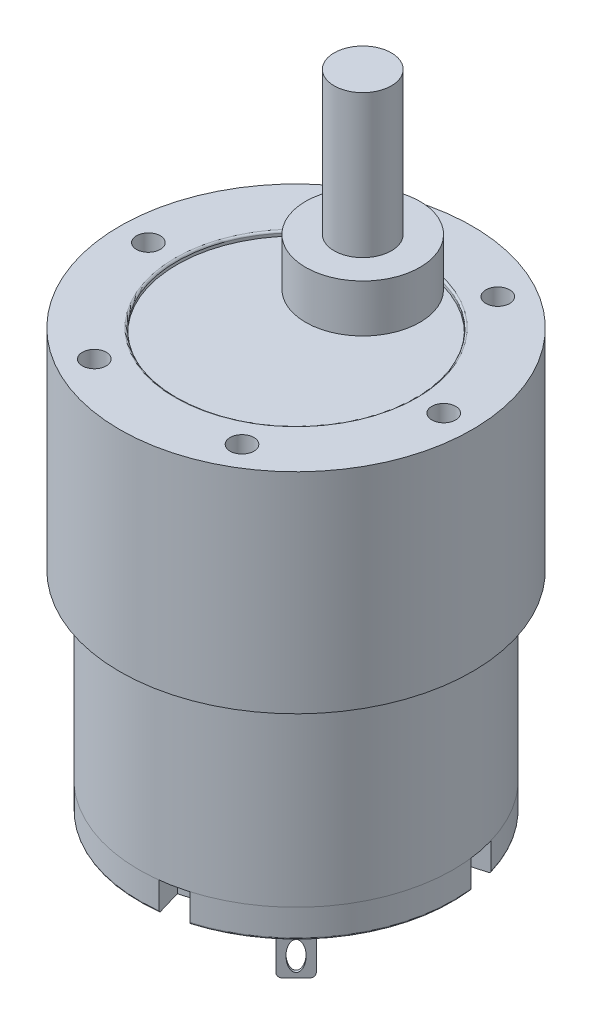
from build123d import *

# Parameters (mm, degrees)
PATTERN_CIRCULAR_1_COUNT = 6
SKETCH_4_R               = 6
EXTRUDE_1_DEPTH          = 5
SKETCH_5_R               = 3
EXTRUDE_2_DEPTH          = 15
SKETCH_6_R               = 3.75
EXTRUDE_3_DEPTH          = 3
SKETCH_7_R               = 1
EXTRUDE_4_DEPTH          = 7
CUT_EXTRUDE_START        = -3
CUT_EXTRUDE_1_DEPTH      = 3
PATTERN_CIRCULAR_2_COUNT = 4
EXTRUDE_5_DEPTH          = 6.5
SKETCH_10_RX             = 1.5
SKETCH_10_RY             = 0.75
CUT_EXTRUDE_2_DEPTH      = 3
FILLET_1_R               = 0.5


with BuildPart() as part:
    # 草图1 → 旋转1 (revolve)
    with BuildSketch(Plane.XY, mode=Mode.PRIVATE) as revolve_1_sk:
        with BuildLine():
            Line((0, -0.5), (0, -44))
            Line((0, -44), (16.28, -44))
            ThreePointArc((16.28, -44), (16.421421356, -43.941421356), (16.48, -43.8))
            Line((16.48, -43.8), (16.48, -41))
            Line((16.48, -41), (16.5, -41))
            Line((16.5, -41), (16.5, -22))
            Line((16.5, -22), (18.5, -22))
            Line((18.5, -22), (18.5, 0))
            Line((18.5, 0), (12.7, 0))
            ThreePointArc((12.7, 0), (12.558578644, -0.058578644), (12.5, -0.2))
            Line((12.5, -0.2), (12.5, -0.5))
            Line((12.5, -0.5), (0, -0.5))
        make_face()
    revolve(revolve_1_sk.sketch.rotate(Axis((0, -0.5, 0), (0, -1, 0)), 90), axis=Axis((0, -0.5, 0), (0, -1, 0)))

    # 草图2 → M3 螺纹孔1 (revolve, cut)
    with BuildSketch(Plane(origin=(-15.5, 0, 0), x_dir=(0, 0, 1), z_dir=(1, 0, 0))):
        Polygon((0, 0), (0, 9.251075774), (1.25, 8.5), (1.25, 0), align=None)
    hole_wizard_m3_1 = revolve(axis=Axis((-15.5, 6.35, 0), (0, -1, 0)), mode=Mode.SUBTRACT)

    # 阵列(圆周)1: M3 螺纹孔1 ×6 about axis
    pattern_circular_1_axis = Axis((0, 0, 0), (0, 1, 0))
    for i in range(1, PATTERN_CIRCULAR_1_COUNT):
        add(hole_wizard_m3_1.rotate(pattern_circular_1_axis, i * 360 / PATTERN_CIRCULAR_1_COUNT), mode=Mode.SUBTRACT)

    # 草图4 → 凸台-拉伸1 (add)
    with BuildSketch(Plane(origin=(0, 0, 0), x_dir=(1, 0, 0), z_dir=(0, 1, 0))):
        with Locations(Location((0, 7, 0), (0, 0, 65.259733828))):
            Circle(SKETCH_4_R)
    extrude(amount=EXTRUDE_1_DEPTH)

    # 草图5 → 凸台-拉伸2 (add)
    with BuildSketch(Plane(origin=(0, 5, 0), x_dir=(1, 0, 0), z_dir=(0, 1, 0))):
        with Locations(Location((0, 7, 0), (0, 0, 180))):
            Circle(SKETCH_5_R)
    extrude(amount=EXTRUDE_2_DEPTH)

    # 草图6 → 凸台-拉伸3 (add)
    with BuildSketch(Plane.XZ.offset(44)):
        with Locations(Location((0, 0, 0), (0, 0, 90))):
            Circle(SKETCH_6_R)
    extrude(amount=EXTRUDE_3_DEPTH)

    # 草图7 → 凸台-拉伸4 (add)
    with BuildSketch(Plane.XZ.offset(47)):
        with Locations(Location((0, 0, 0), (0, 0, 270))):
            Circle(SKETCH_7_R)
    extrude(amount=EXTRUDE_4_DEPTH)

    # 草图8 → 切除-拉伸1 (cut)
    with BuildSketch(Plane.XZ.offset(44).offset(CUT_EXTRUDE_START)):
        with BuildLine():
            Line((-4.674811946, -15.803054555), (-3.814208524, -12.893811788))
            Line((-3.814208524, -12.893811788), (-1.200764091, -13.66691304))
            Line((-1.200764091, -13.66691304), (-1.996998191, -16.358557339))
            ThreePointArc((-1.996998191, -16.358557339), (-3.347448052, -16.136449161), (-4.674811946, -15.803054555))
        make_face()
    cut_extrude_1 = extrude(amount=CUT_EXTRUDE_1_DEPTH, mode=Mode.SUBTRACT)

    # 阵列(圆周)2: 切除-拉伸1 ×4 about axis
    pattern_circular_2_axis = Axis((0, 0, 0), (0, 1, 0))
    for i in range(1, PATTERN_CIRCULAR_2_COUNT):
        add(cut_extrude_1.rotate(pattern_circular_2_axis, i * 360 / PATTERN_CIRCULAR_2_COUNT), mode=Mode.SUBTRACT)

    # 草图9 → 凸台-拉伸5 (add)
    with BuildSketch(Plane.XZ.offset(44)):
        Polygon((-9.439875529, -7.318555185), (-7.318555185, -9.439875529), (-7.53068722, -9.652007563), (-9.652007563, -7.53068722), align=None)
        Polygon((7.53068722, 9.652007563), (7.318555185, 9.439875529), (9.439875529, 7.318555185), (9.652007563, 7.53068722), align=None)
    extrude(amount=EXTRUDE_5_DEPTH)

    # 草图10 → 切除-拉伸2 (cut)
    with BuildSketch(Plane(origin=(-8.591347391, 0, -8.591347391), x_dir=(-0.7071067811865307, 0, 0.7071067811865643), z_dir=(-0.7071067811865643, 0, -0.7071067811865307))):
        with Locations(Location((0, -48.5), (0, 0, -90))):
            Ellipse(SKETCH_10_RX, SKETCH_10_RY)
    cut_extrude_2 = extrude(amount=-CUT_EXTRUDE_2_DEPTH, mode=Mode.SUBTRACT)

    # 圆角1
    fillet_1_edges = [part.edges().sort_by_distance(p)[0] for p in [
        (7.424621202, -50.5, 9.545941546),
        (9.545941546, -50.5, 7.424621202),
        (-7.424621202, -50.5, -9.545941546),
        (-9.545941546, -50.5, -7.424621202),
    ]]
    fillet(fillet_1_edges, radius=FILLET_1_R)

    # 镜向5: 切除-拉伸2 across plane
    add(cut_extrude_2.mirror(Plane(origin=(0, 0, 0), x_dir=(-0.7071067811865388, 0, 0.7071067811865562), z_dir=(-0.7071067811865562, 0, -0.7071067811865388))), mode=Mode.SUBTRACT)


solid = part.part
